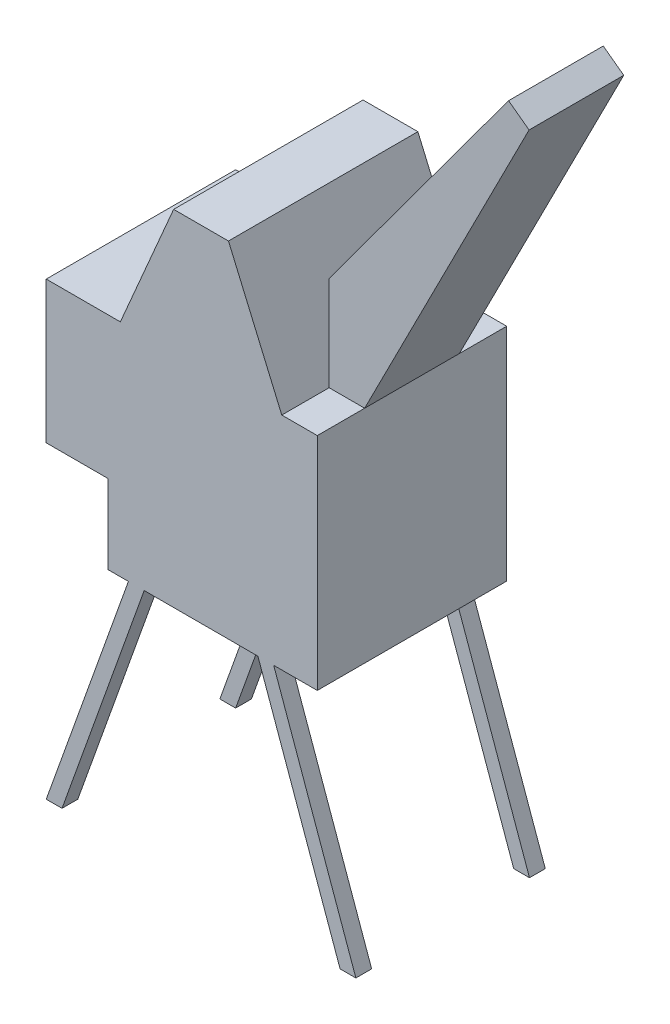
from build123d import *

# Parameters (mm, degrees)
BOSS_EXTRUDE1_DEPTH = 609.6
BOSS_EXTRUDE2_DEPTH = 304.8
BOSS_EXTRUDE3_DEPTH = 101.6


with BuildPart() as part:
    # Sketch2 → Boss-Extrude1 (new, symmetric)
    with BuildSketch(Plane.XY):
        Polygon((397.181123676, 1478.724407172), (1744.83154289, 1478.724407172), (1744.83154289, 2899.732664245), (1516.23154289, 2899.732664245), (1173.053103307, 3698.520098923), (820.161879734, 3698.520098923), (476.983440152, 2899.732664245), (0, 2899.732664245), (0, 1986.756947693), (397.181123676, 1986.756947693), align=None)
    extrude(amount=BOSS_EXTRUDE1_DEPTH, both=True)

    # Sketch3 → Boss-Extrude2 (add, symmetric)
    with BuildSketch(Plane.XY):
        Polygon((1516.23154289, 3509.332664245), (1516.23154289, 2899.732664245), (1744.83154289, 2899.732664245), (2803.237053345, 4980.22399095), (2671.227131095, 5077.455456827), align=None)
    extrude(amount=BOSS_EXTRUDE2_DEPTH, both=True)

    # Sketch4 → Boss-Extrude3 (add)
    with BuildSketch(Plane.XY.offset(609.6)):
        Polygon((529.010881251, 1478.724407172), (0, 0), (101.6, 0), (630.610881251, 1478.724407172), align=None)
        Polygon((1464.20410179, 1478.724407172), (1362.60410179, 1478.724407172), (1891.614983041, 0), (1993.214983041, 0), align=None)
    boss_extrude3 = extrude(amount=-BOSS_EXTRUDE3_DEPTH)

    # Mirror1: Boss-Extrude3 across plane
    add(boss_extrude3.mirror(Plane.XY))


solid = part.part
